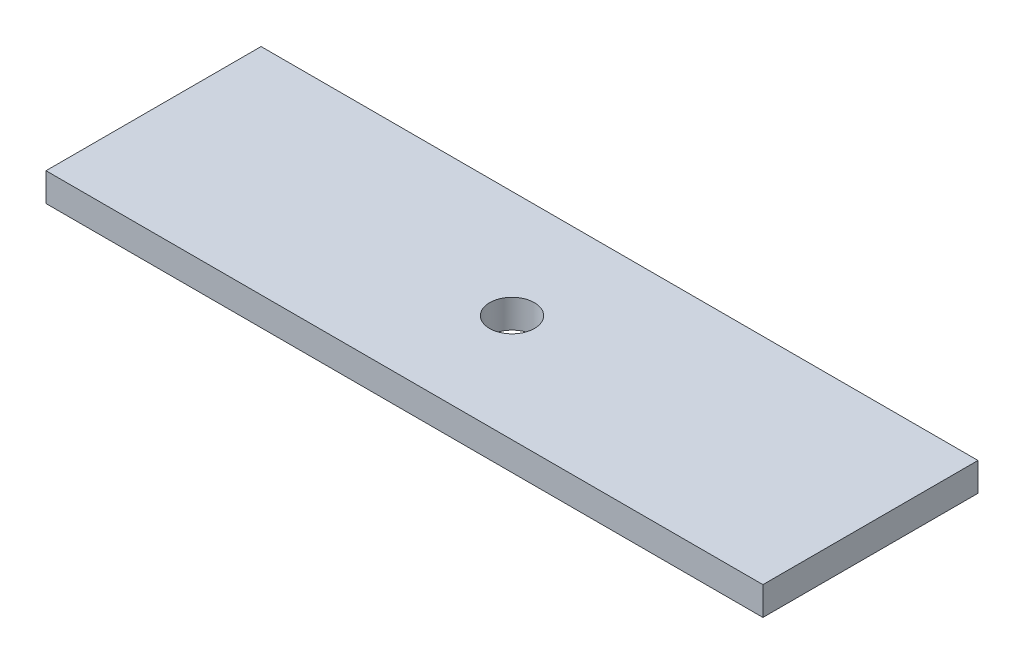
from build123d import *

# Parameters (mm, degrees)
SKETCH1_W           = 40
SKETCH1_H           = 12
SKETCH1_R           = 1.25
BOSS_EXTRUDE1_DEPTH = 1.5875


with BuildPart() as part:
    # Sketch1 → Boss-Extrude1 (new body)
    with BuildSketch(Plane(origin=(0, 0, 0), x_dir=(1, 0, 0), z_dir=(0, 1, 0))):
        Rectangle(SKETCH1_W, SKETCH1_H)
        with Locations(Location((0, 0, 0), (0, 0, 270))):
            Circle(SKETCH1_R, mode=Mode.SUBTRACT)
    extrude(amount=BOSS_EXTRUDE1_DEPTH)


solid = part.part
